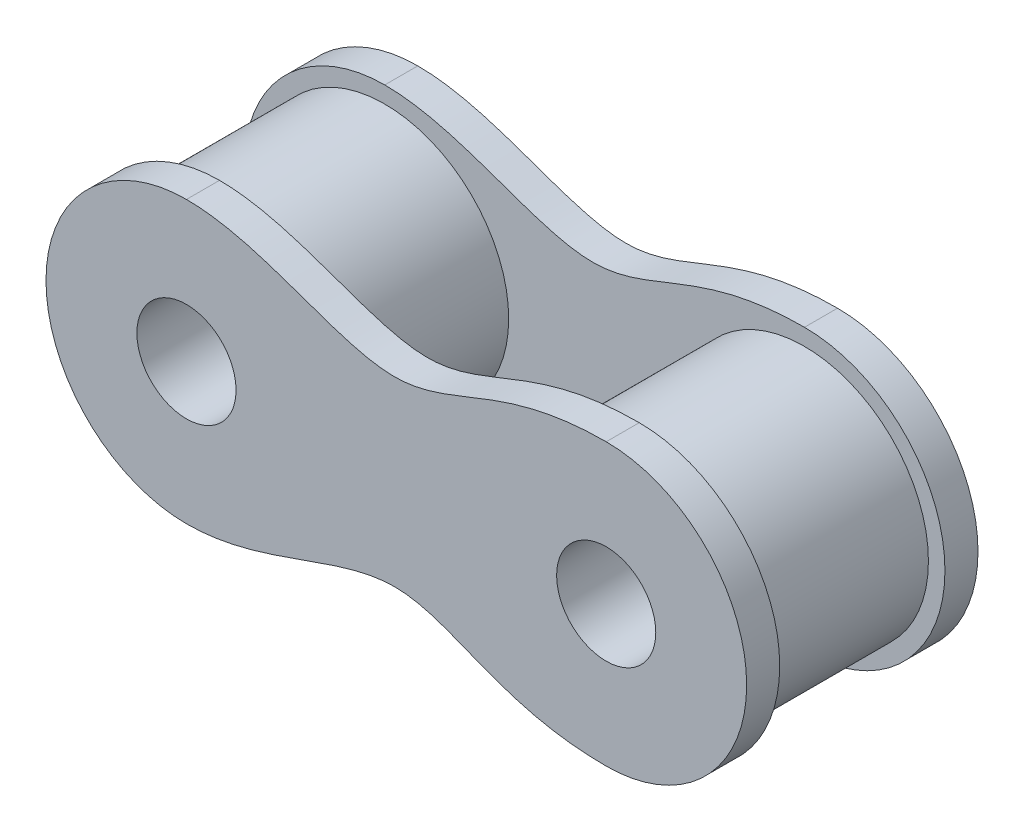
from build123d import *

# Parameters (mm, degrees)
SKETCH1_R             = 3.75
SKETCH1_R_2           = 1.5
BOSS_EXTRUDE1_DEPTH   = 5
BOSS_EXTRUDE1_2_DEPTH = 5
SKETCH3_R             = 1.5
BOSS_EXTRUDE2_DEPTH   = 1
BOSS_EXTRUDE3_START   = 1
SKETCH4_R             = 1.5
BOSS_EXTRUDE3_DEPTH   = 1


with BuildPart() as part:
    # Sketch1 → Boss-Extrude1 (new body)
    with BuildSketch(Plane.XY):
        Circle(SKETCH1_R)
        Circle(SKETCH1_R_2, mode=Mode.SUBTRACT)
    extrude(amount=BOSS_EXTRUDE1_DEPTH)



with BuildPart() as body_2:
    # Sketch1 → Boss-Extrude1 2 (new body)
    with BuildSketch(Plane.XY):
        with Locations((12.7, 0)):
            Circle(SKETCH1_R)
        with Locations((12.7, 0)):
            Circle(SKETCH1_R_2, mode=Mode.SUBTRACT)
    extrude(amount=BOSS_EXTRUDE1_2_DEPTH)


with BuildPart() as part_1:
    add(part.part)

    add(body_2.part)  # Boss-Extrude2 merges body 2
    # Sketch3 → Boss-Extrude2 (add)
    with BuildSketch(Plane.XY.offset(5)):
        with BuildLine():
            ThreePointArc((0, 4.25), (-4.25, 0), (0, -4.25))
            add(Edge.make_bspline(
                [(0, -4.25), (2.289040146, -4.25), (6.757680167, -1.249332431), (9.408381706, -4.25), (12.7, -4.25)],
                knots=[0, 0, 0, 0, 0.492542227, 1, 1, 1, 1], degree=3))
            ThreePointArc((12.7, -4.25), (16.95, 0), (12.7, 4.25))
            add(Edge.make_bspline(
                [(0, 4.25), (2.289040146, 4.25), (6.757680167, 1.249332431), (9.408381706, 4.25), (12.7, 4.25)],
                knots=[0, 0, 0, 0, 0.492542227, 1, 1, 1, 1], degree=3))
        make_face()
        with Locations((12.7, 0)):
            Circle(SKETCH3_R, mode=Mode.SUBTRACT)
        Circle(SKETCH3_R, mode=Mode.SUBTRACT)
    extrude(amount=BOSS_EXTRUDE2_DEPTH)

    # Sketch4 → Boss-Extrude3 (add)
    with BuildSketch(Plane(origin=(0, 0, 0), x_dir=(-1, 0, 0), z_dir=(0, 0, -1)).offset(BOSS_EXTRUDE3_START)):
        with BuildLine():
            ThreePointArc((0, -4.25), (4.25, 0), (0, 4.25))
            add(Edge.make_bspline(
                [(-12.7, 4.25), (-9.408381706, 4.25), (-6.757680167, 1.249332431), (-2.289040146, 4.25), (0, 4.25)],
                knots=[0, 0, 0, 0, 0.507457773, 1, 1, 1, 1], degree=3))
            ThreePointArc((-12.7, 4.25), (-16.95, 0), (-12.7, -4.25))
            add(Edge.make_bspline(
                [(0, -4.25), (-2.289040146, -4.25), (-6.757680167, -1.249332431), (-9.408381706, -4.25), (-12.7, -4.25)],
                knots=[0, 0, 0, 0, 0.492542227, 1, 1, 1, 1], degree=3))
        make_face()
        Circle(SKETCH4_R, mode=Mode.SUBTRACT)
        with Locations((-12.7, 0)):
            Circle(SKETCH4_R, mode=Mode.SUBTRACT)
    extrude(amount=-BOSS_EXTRUDE3_DEPTH)


solid = part_1.part
